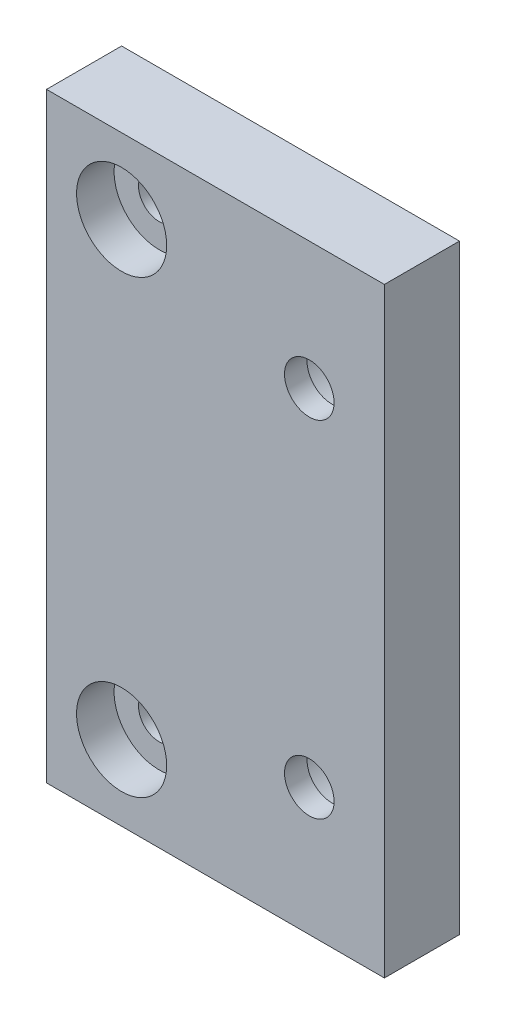
from build123d import *

# Parameters (mm, degrees)
ESQUISSE1_W             = 45
ESQUISSE1_H             = 80
ESQUISSE1_R             = 3.3
ESQUISSE1_R_2           = 2.75
BOSS_EXTRU_1_DEPTH      = 10
ESQUISSE2_R             = 6
ENL_V_MAT_EXTRU_1_DEPTH = 5
ESQUISSE3_R             = 7
ENL_V_MAT_EXTRU_3_DEPTH = 7


with BuildPart() as part:
    # Esquisse1 → Boss.-Extru.1 (new body)
    with BuildSketch(Plane.XY):
        with Locations((-13.678136106, 1.138047212)):
            Rectangle(ESQUISSE1_W, ESQUISSE1_H)
        with Locations((-1.178136106, 24.138047212)):
            Circle(ESQUISSE1_R, mode=Mode.SUBTRACT)
        with Locations((-1.178136106, -21.861952788)):
            Circle(ESQUISSE1_R, mode=Mode.SUBTRACT)
        with Locations((-26.178136106, 31.138047212)):
            Circle(ESQUISSE1_R_2, mode=Mode.SUBTRACT)
        with Locations((-26.178136106, -28.861952788)):
            Circle(ESQUISSE1_R_2, mode=Mode.SUBTRACT)
    extrude(amount=BOSS_EXTRU_1_DEPTH)

    # Esquisse2 → Enlèv. mat.-Extru.1 (cut)
    with BuildSketch(Plane.XY.offset(10)):
        with Locations((-26.178136106, 31.138047212)):
            Circle(ESQUISSE2_R)
        with Locations((-26.178136106, -28.861952788)):
            Circle(ESQUISSE2_R)
    extrude(amount=-ENL_V_MAT_EXTRU_1_DEPTH, mode=Mode.SUBTRACT)

    # Esquisse3 → Enlèv. mat.-Extru.3 (cut)
    with BuildSketch(Plane(origin=(0, 0, 0), x_dir=(-1, 0, 0), z_dir=(0, 0, -1))):
        with Locations((1.178136106, 24.138047212)):
            Circle(ESQUISSE3_R)
        with Locations((1.178136106, -21.861952788)):
            Circle(ESQUISSE3_R)
    extrude(amount=-ENL_V_MAT_EXTRU_3_DEPTH, mode=Mode.SUBTRACT)


solid = part.part
